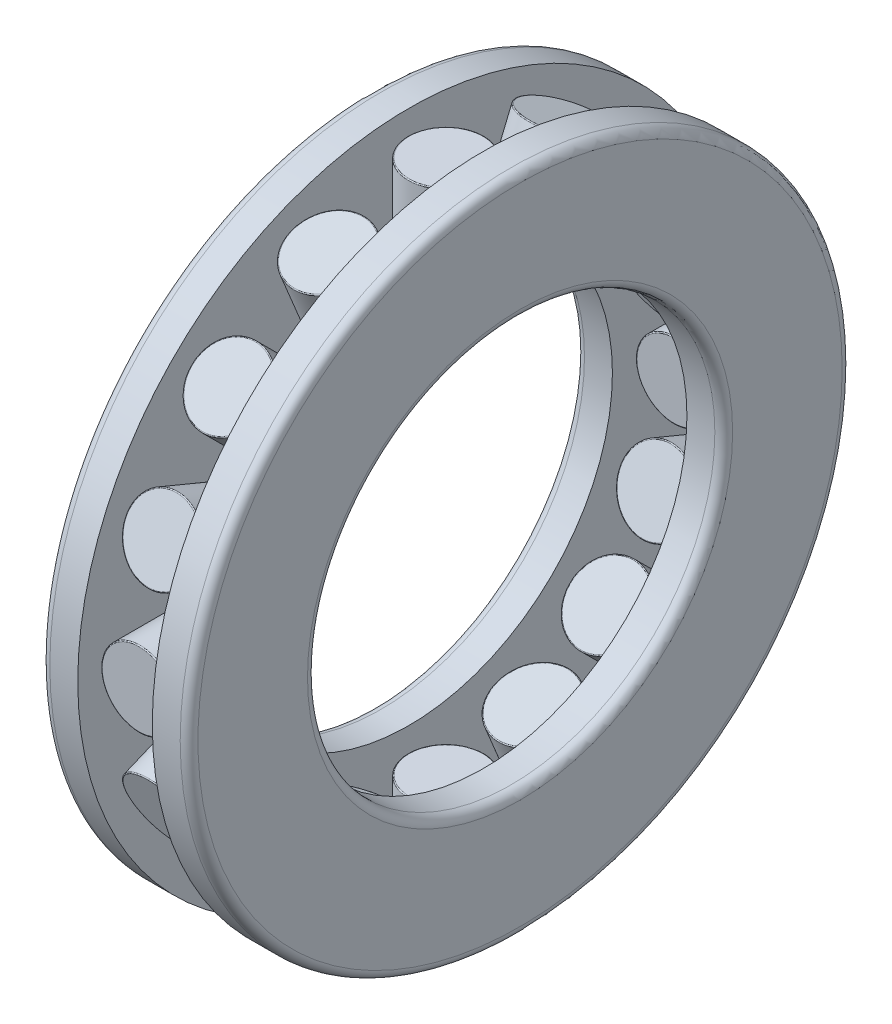
from build123d import *

# Parameters (mm, degrees)
CIRPATTERN1_COUNT = 16


with BuildPart() as part:
    # Sketch1 → Base-Revolve (revolve)
    with BuildSketch(Plane.XY):
        with BuildLine():
            Line((-6.3881, 56.75376), (-6.3881, 34.925))
            Line((-6.3881, 34.925), (-11.176, 34.925))
            ThreePointArc((-11.176, 34.925), (-12.253630735, 35.371369265), (-12.7, 36.449))
            Line((-12.7, 36.449), (-12.7, 55.22976))
            ThreePointArc((-12.7, 55.22976), (-12.253630735, 56.307390735), (-11.176, 56.75376))
            Line((-11.176, 56.75376), (-6.3881, 56.75376))
        make_face()
    revolve(axis=Axis((-34.925, 0, 0), (1, 0, 0)))

    # Sketch2 → Boss-Revolve1 (revolve)
    with BuildSketch(Plane.XY):
        with BuildLine():
            Line((6.315075, 39.042636333), (0, 39.042636333))
            Line((0, 39.042636333), (0, 52.636123667))
            Line((0, 52.636123667), (6.315075, 52.636123667))
            ThreePointArc((6.315075, 52.636123667), (6.429573266, 52.588696932), (6.477, 52.474198667))
            Line((6.477, 52.474198667), (6.477, 39.204561333))
            ThreePointArc((6.477, 39.204561333), (6.429573266, 39.090063068), (6.315075, 39.042636333))
        make_face()
    boss_revolve1 = revolve(axis=Axis((0, 30.559248, 0), (0, 1, 0)))

    # CirPattern1: Boss-Revolve1 ×16 about axis
    cirpattern1_axis = Axis((-50, 0, 0), (1, 0, 0))
    for i in range(1, CIRPATTERN1_COUNT):
        add(boss_revolve1.rotate(cirpattern1_axis, i * 360 / CIRPATTERN1_COUNT))

    # Sketch3 → Boss-Revolve2 (revolve)
    with BuildSketch(Plane.XY):
        with BuildLine():
            Line((6.3881, 56.75376), (6.3881, 34.925))
            Line((6.3881, 34.925), (11.176, 34.925))
            ThreePointArc((11.176, 34.925), (12.253630735, 35.371369265), (12.7, 36.449))
            Line((12.7, 36.449), (12.7, 55.22976))
            ThreePointArc((12.7, 55.22976), (12.253630735, 56.307390735), (11.176, 56.75376))
            Line((11.176, 56.75376), (6.3881, 56.75376))
        make_face()
    revolve(axis=Axis((-34.925, 0, 0), (1, 0, 0)))


solid = part.part
